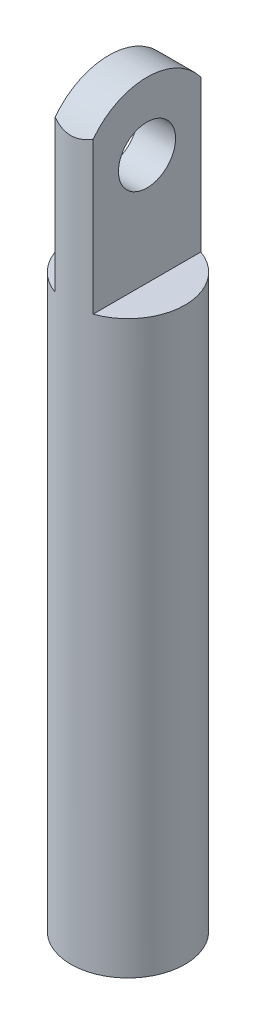
from build123d import *

# Parameters (mm, degrees)
SKETCH1_R               = 3
BOSS_EXTRUDE1_DEPTH     = 30
BOSS_EXTRUDE2_START     = 10
BOSS_EXTRUDE2_DEPTH     = 10
SKETCH2_R               = 1.5
CUT_EXTRUDE1_DEPTH      = 10
CUT_EXTRUDE2_DEPTH      = 31.413812651
CUT_EXTRUDE2_DEPTH_BACK = 31.413812651


with BuildPart() as part:
    # Sketch1 → Boss-Extrude1 (new body)
    with BuildSketch(Plane(origin=(0, 0, 0), x_dir=(1, 0, 0), z_dir=(0, 1, 0))):
        Circle(SKETCH1_R)
    extrude(amount=-BOSS_EXTRUDE1_DEPTH)

    # Sketch1<3> → Boss-Extrude2 (add)
    with BuildSketch(Plane(origin=(0, 0, 0), x_dir=(1, 0, 0), z_dir=(0, 1, 0)).offset(BOSS_EXTRUDE2_START)):
        with BuildLine():
            ThreePointArc((-1, -2.828427125), (0, -3), (1, -2.828427125))
            Line((1, -2.828427125), (1, 2.828427125))
            ThreePointArc((1, 2.828427125), (0, 3), (-1, 2.828427125))
            Line((-1, 2.828427125), (-1, -2.828427125))
        make_face()
    extrude(amount=-BOSS_EXTRUDE2_DEPTH)

    # Sketch2 → Cut-Extrude1 (cut)
    with BuildSketch(Plane(origin=(1, 0, 0), x_dir=(0, 0, -1), z_dir=(1, 0, 0))):
        with Locations((0, 5.828656685)):
            Circle(SKETCH2_R)
    extrude(amount=-CUT_EXTRUDE1_DEPTH, mode=Mode.SUBTRACT)

    # Sketch3 → Cut-Extrude2 (cut, two sides: drawn at the far end of the back side and taken through both)
    with BuildSketch(Plane(origin=(1, 0, 0), x_dir=(0, 0, -1), z_dir=(1, 0, 0)).offset(-CUT_EXTRUDE2_DEPTH_BACK)):
        with BuildLine():
            Line((3.541708321, 5.828656685), (6.198168723, 5.828656685))
            Line((6.198168723, 5.828656685), (6.198168723, 11.427002628))
            Line((6.198168723, 11.427002628), (-4.798582237, 11.427002628))
            Line((-4.798582237, 11.427002628), (-4.798582237, 5.828656685))
            Line((-4.798582237, 5.828656685), (-3.541708321, 5.828656685))
            ThreePointArc((-3.541708321, 5.828656685), (0, 9.370365006), (3.541708321, 5.828656685))
        make_face()
    extrude(amount=CUT_EXTRUDE2_DEPTH + CUT_EXTRUDE2_DEPTH_BACK, mode=Mode.SUBTRACT)


solid = part.part
